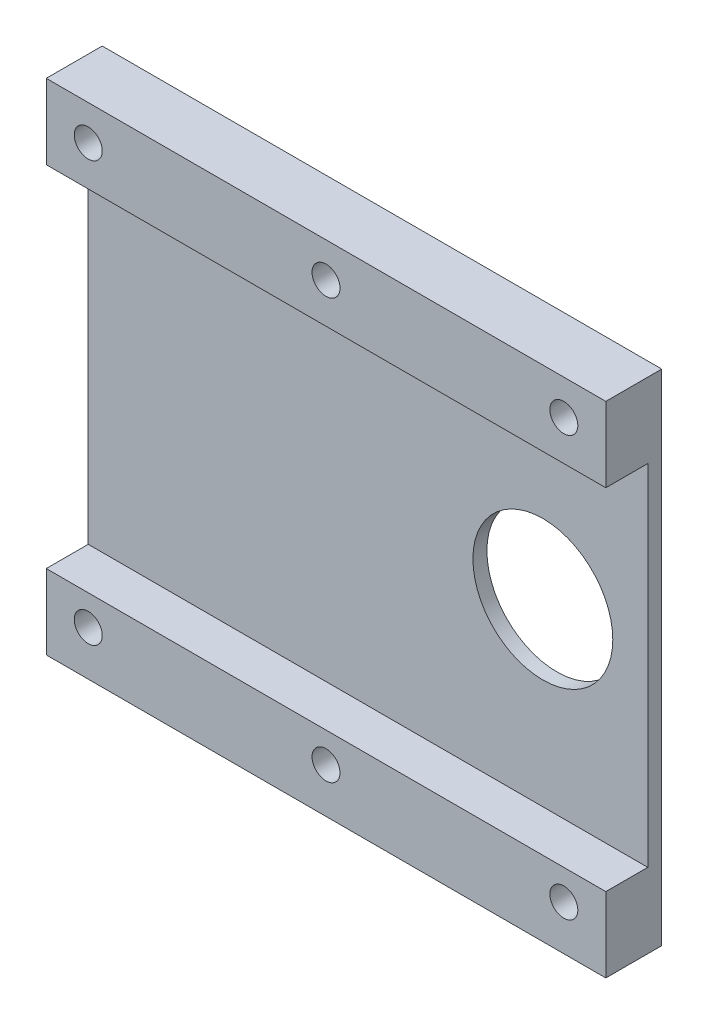
from build123d import *

# Parameters (mm, degrees)
SKETCH1_W           = 40
SKETCH1_H           = 35.7
SKETCH1_R           = 1
BOSS_EXTRUDE1_DEPTH = 4
SKETCH2_W           = 50
SKETCH2_H           = 25
CUT_EXTRUDE1_DEPTH  = 3
SKETCH3_R           = 1
CUT_EXTRUDE2_DEPTH  = 3
SKETCH4_R           = 5
CUT_EXTRUDE3_DEPTH  = 28.103920381


with BuildPart() as part:
    # Sketch1 → Boss-Extrude1 (new body)
    with BuildSketch(Plane.XY):
        Rectangle(SKETCH1_W, SKETCH1_H)
        with Locations((-17, 15.35)):
            Circle(SKETCH1_R, mode=Mode.SUBTRACT)
        with Locations((0, 15.35)):
            Circle(SKETCH1_R, mode=Mode.SUBTRACT)
        with Locations((17, 15.35)):
            Circle(SKETCH1_R, mode=Mode.SUBTRACT)
        with Locations((-17, -14.65)):
            Circle(SKETCH1_R, mode=Mode.SUBTRACT)
        with Locations((0, -14.65)):
            Circle(SKETCH1_R, mode=Mode.SUBTRACT)
        with Locations((17, -14.65)):
            Circle(SKETCH1_R, mode=Mode.SUBTRACT)
    extrude(amount=BOSS_EXTRUDE1_DEPTH)

    # Sketch2 → Cut-Extrude1 (cut)
    with BuildSketch(Plane.XY.offset(4)):
        Rectangle(SKETCH2_W, SKETCH2_H)
    extrude(amount=-CUT_EXTRUDE1_DEPTH, mode=Mode.SUBTRACT)

    # Sketch3 → Cut-Extrude2 (cut)
    with BuildSketch(Plane.XZ.offset(17.85)):
        with Locations((-7.5, 2)):
            Circle(SKETCH3_R)
        with Locations((7.5, 2)):
            Circle(SKETCH3_R)
    extrude(amount=-CUT_EXTRUDE2_DEPTH, mode=Mode.SUBTRACT)

    # Sketch4 → Cut-Extrude3 (cut, through all)
    with BuildSketch(Plane(origin=(0, 0, 0), x_dir=(-1, 0, 0), z_dir=(0, 0, -1))):
        with Locations((-12.5, 0.35)):
            Circle(SKETCH4_R)
    extrude(amount=-CUT_EXTRUDE3_DEPTH, mode=Mode.SUBTRACT)


solid = part.part
